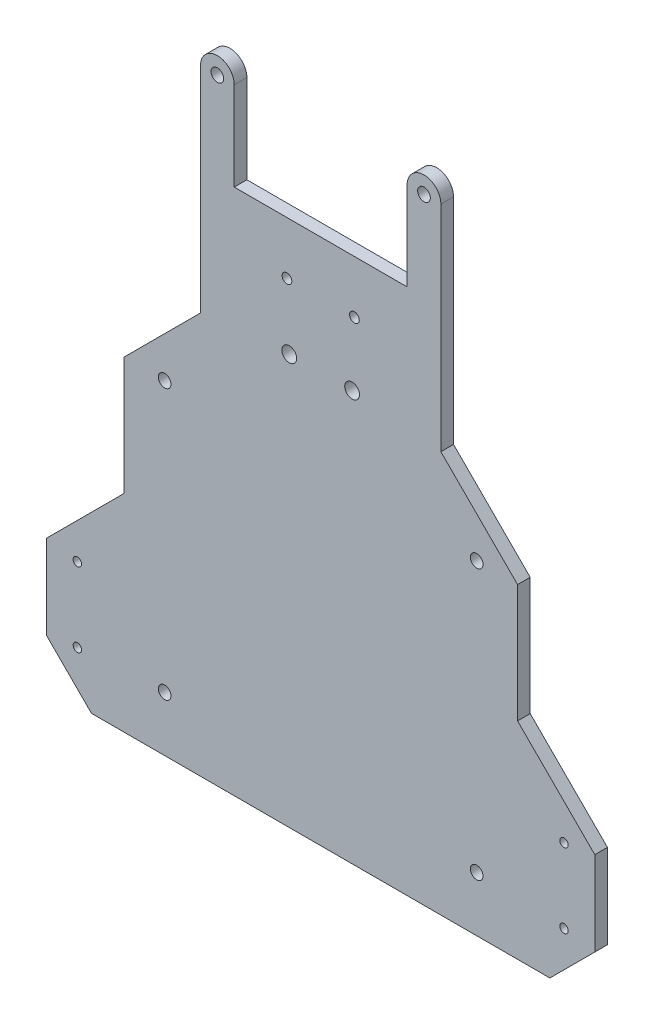
from build123d import *

# Parameters (mm, degrees)
MODEL_R         = 1.75
MODEL_R_2       = 1.15
MODEL_R_3       = 1.5
MODEL_R_4       = 1
EXTRUDE_1_DEPTH = 3


with BuildPart() as part:
    # Model → 凸台-拉伸1 (new body)
    with BuildSketch(Plane.XY):
        with BuildLine():
            Line((-46.68918008, 48.963412214), (-65, 30.652592295))
            Line((-65, 30.652592295), (-65, 10.652592295))
            Line((-65, 10.652592295), (-54.347407705, 0))
            Line((-54.347407705, 0), (54.347407705, 0))
            Line((54.347407705, 0), (65, 10.652592295))
            Line((65, 10.652592295), (65, 30.652592295))
            Line((65, 30.652592295), (46.68918008, 48.963412214))
            Line((46.68918008, 48.963412214), (46.68918008, 76.963412214))
            Line((46.68918008, 76.963412214), (28.5, 95.152592295))
            Line((28.5, 95.152592295), (28.5, 146))
            ThreePointArc((28.5, 146), (24.5, 150), (20.5, 146))
            Line((20.5, 146), (20.5, 125))
            Line((20.5, 125), (-20.5, 125))
            Line((-20.5, 125), (-20.5, 146))
            ThreePointArc((-20.5, 146), (-24.5, 150), (-28.5, 146))
            Line((-28.5, 146), (-28.5, 95.152592295))
            Line((-28.5, 95.152592295), (-46.68918008, 76.963412214))
            Line((-46.68918008, 76.963412214), (-46.68918008, 48.963412214))
        make_face()
        with Locations((7.45, 97.194870059)):
            Circle(MODEL_R, mode=Mode.SUBTRACT)
        with Locations(Location((8, 112.5, 0), (0, 0, 180))):
            Circle(MODEL_R_2, mode=Mode.SUBTRACT)
        with Locations((-24.5, 146)):
            Circle(MODEL_R_3, mode=Mode.SUBTRACT)
        with Locations((37, 13)):
            Circle(MODEL_R_3, mode=Mode.SUBTRACT)
        with Locations((37, 77)):
            Circle(MODEL_R_3, mode=Mode.SUBTRACT)
        with Locations((57.7, 11.852592295)):
            Circle(MODEL_R_4, mode=Mode.SUBTRACT)
        with Locations((-57.7, 11.852592295)):
            Circle(MODEL_R_4, mode=Mode.SUBTRACT)
        with Locations((-57.7, 29.452592295)):
            Circle(MODEL_R_4, mode=Mode.SUBTRACT)
        with Locations((57.7, 29.452592295)):
            Circle(MODEL_R_4, mode=Mode.SUBTRACT)
        with Locations((-37, 77)):
            Circle(MODEL_R_3, mode=Mode.SUBTRACT)
        with Locations((-37, 13)):
            Circle(MODEL_R_3, mode=Mode.SUBTRACT)
        with Locations((24.5, 146)):
            Circle(MODEL_R_3, mode=Mode.SUBTRACT)
        with Locations((-8, 112.5)):
            Circle(MODEL_R_2, mode=Mode.SUBTRACT)
        with Locations((-7.45, 97.194870059)):
            Circle(MODEL_R, mode=Mode.SUBTRACT)
    extrude(amount=EXTRUDE_1_DEPTH)


solid = part.part
